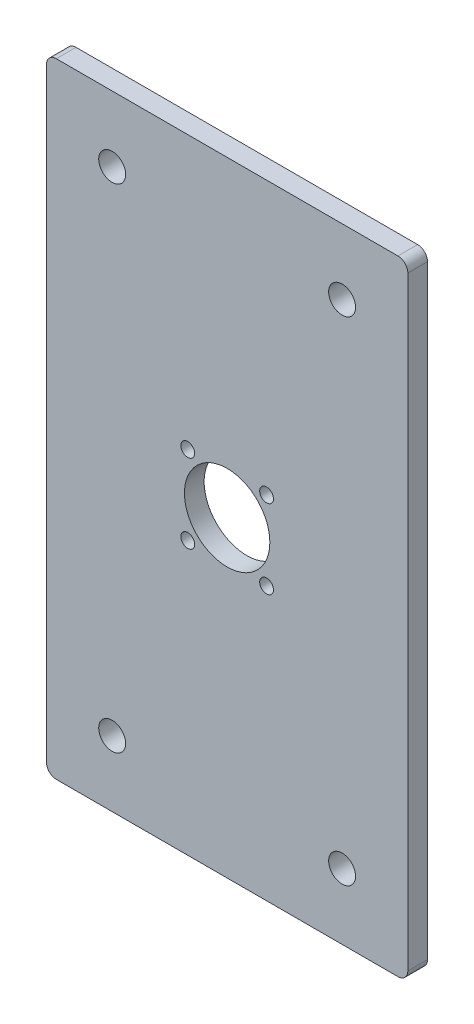
from build123d import *

# Parameters (mm, degrees)
SKETCH1_W                = 110
SKETCH1_H                = 190
BOSS_EXTRUDE1_DEPTH      = 6
CUT_EXTRUDE1_REACH       = 111.936
SKETCH2_R                = 13
CUT_EXTRUDE2_REACH       = 111.936
SKETCH3_R                = 4.1
FILLET1_R                = 3
M4_CLEARANCE_HOLE1_D     = 4.2
M4_CLEARANCE_HOLE1_DEPTH = 19.75
M4_CLEARANCE_HOLE1_TIP   = 1.2618073


with BuildPart() as part:
    # Sketch1 → Boss-Extrude1 (new body)
    with BuildSketch(Plane.XY):
        Rectangle(SKETCH1_W, SKETCH1_H)
    extrude(amount=BOSS_EXTRUDE1_DEPTH)

    # Sketch2 → Cut-Extrude1 (cut, up to next)
    with BuildSketch(Plane.XY.offset(6), mode=Mode.PRIVATE) as cut_extrude1_sk1:
        Circle(SKETCH2_R)
    cut_extrude1_tool1 = extrude(cut_extrude1_sk1.sketch, amount=-CUT_EXTRUDE1_REACH, mode=Mode.PRIVATE) & part.part
    add(cut_extrude1_tool1.solids().sort_by_distance((0, 0, 6))[0], mode=Mode.SUBTRACT)

    # Sketch3 → Cut-Extrude2 (cut, up to next)
    with BuildSketch(Plane.XY.offset(6), mode=Mode.PRIVATE) as cut_extrude2_sk1:
        with Locations((-35, 75)):
            Circle(SKETCH3_R)
    cut_extrude2_tool1 = extrude(cut_extrude2_sk1.sketch, amount=-CUT_EXTRUDE2_REACH, mode=Mode.PRIVATE) & part.part
    # Sketch3 → Cut-Extrude2 (cut, up to next)
    with BuildSketch(Plane.XY.offset(6), mode=Mode.PRIVATE) as cut_extrude2_sk2:
        with Locations((35, 75)):
            Circle(SKETCH3_R)
    cut_extrude2_tool2 = extrude(cut_extrude2_sk2.sketch, amount=-CUT_EXTRUDE2_REACH, mode=Mode.PRIVATE) & part.part
    # Sketch3 → Cut-Extrude2 (cut, up to next)
    with BuildSketch(Plane.XY.offset(6), mode=Mode.PRIVATE) as cut_extrude2_sk3:
        with Locations((35, -75)):
            Circle(SKETCH3_R)
    cut_extrude2_tool3 = extrude(cut_extrude2_sk3.sketch, amount=-CUT_EXTRUDE2_REACH, mode=Mode.PRIVATE) & part.part
    # Sketch3 → Cut-Extrude2 (cut, up to next)
    with BuildSketch(Plane.XY.offset(6), mode=Mode.PRIVATE) as cut_extrude2_sk4:
        with Locations((-35, -75)):
            Circle(SKETCH3_R)
    cut_extrude2_tool4 = extrude(cut_extrude2_sk4.sketch, amount=-CUT_EXTRUDE2_REACH, mode=Mode.PRIVATE) & part.part
    add(cut_extrude2_tool1.solids().sort_by_distance((-35, 75, 6))[0], mode=Mode.SUBTRACT)
    add(cut_extrude2_tool2.solids().sort_by_distance((35, 75, 6))[0], mode=Mode.SUBTRACT)
    add(cut_extrude2_tool3.solids().sort_by_distance((35, -75, 6))[0], mode=Mode.SUBTRACT)
    add(cut_extrude2_tool4.solids().sort_by_distance((-35, -75, 6))[0], mode=Mode.SUBTRACT)

    # Fillet1
    fillet1_edges = [part.edges().sort_by_distance(p)[0] for p in [
        (-55, -95, 3),
        (55, -95, 3),
        (55, 95, 3),
        (-55, 95, 3),
    ]]
    fillet(fillet1_edges, radius=FILLET1_R)

    # M4 Clearance Hole1
    with Locations(Plane(origin=(-12, 12, 6), x_dir=(1, 0, 0), z_dir=(0, 0, 1))):
        with Locations((0, 0), (24, 0), (24, -24), (0, -24)):
            Hole(M4_CLEARANCE_HOLE1_D / 2, depth=M4_CLEARANCE_HOLE1_DEPTH)
            with Locations((0, 0, -(M4_CLEARANCE_HOLE1_DEPTH + M4_CLEARANCE_HOLE1_TIP / 2))):  # 118° drill point
                Cone(0, M4_CLEARANCE_HOLE1_D / 2, M4_CLEARANCE_HOLE1_TIP, mode=Mode.SUBTRACT)


solid = part.part
